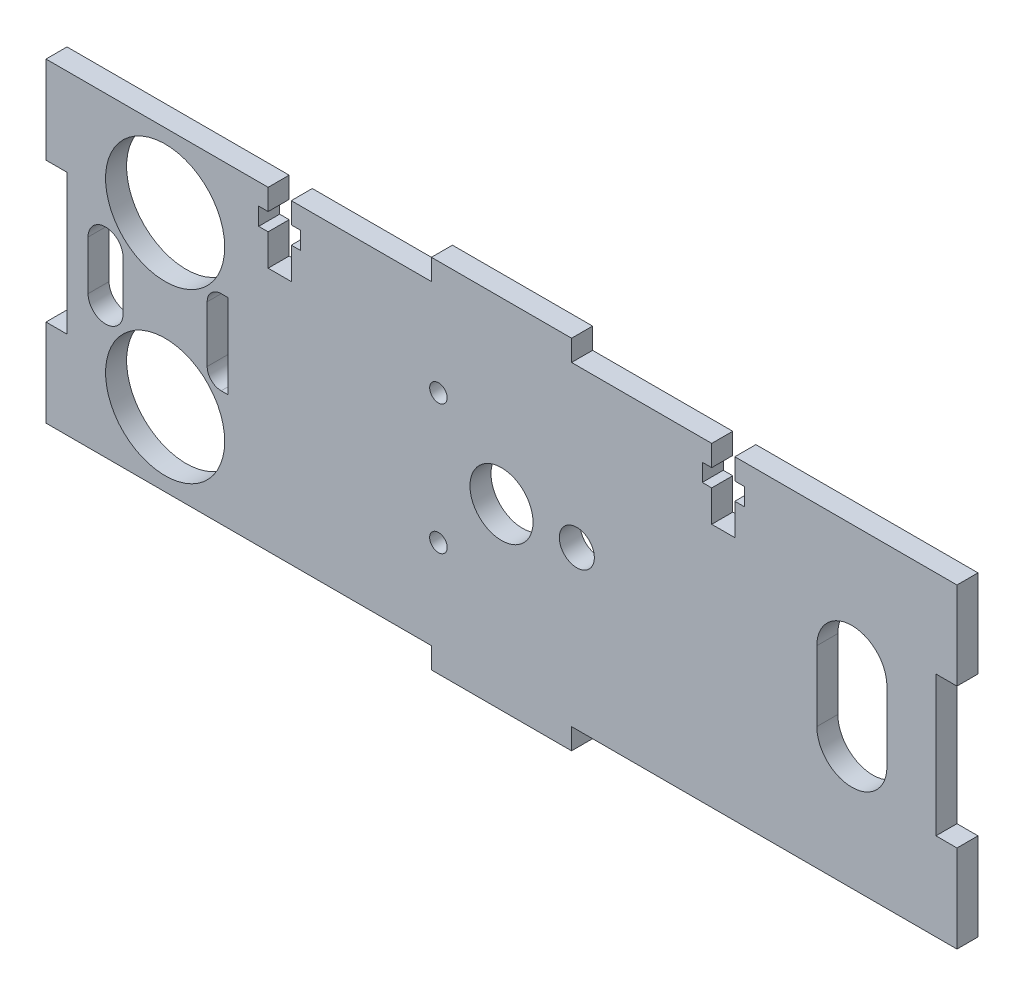
from build123d import *

# Parameters (mm, degrees)
SKETCH1_R           = 8.5
SKETCH1_R_2         = 4.5
SKETCH1_R_3         = 2.5
SKETCH1_R_4         = 1.25
BOSS_EXTRUDE1_DEPTH = 3


with BuildPart() as part:
    # Sketch1 → Boss-Extrude1 (new body)
    with BuildSketch(Plane.XY):
        Polygon((-10, -22.5), (-65, -22.5), (-65, -10), (-62, -10), (-62, 10), (-65, 10), (-65, 22.5), (-33.3, 22.5), (-33.3, 19.5), (-34.65, 19.5), (-34.65, 17), (-33.3, 17), (-33.3, 12.5), (-30, 12.5), (-30, 17), (-28.65, 17), (-28.65, 19.5), (-30, 19.5), (-30, 22.5), (-10, 22.5), (-10, 25.5), (10, 25.5), (10, 22.5), (30, 22.5), (30, 19.5), (28.65, 19.5), (28.65, 17), (30, 17), (30, 12.5), (33.3, 12.5), (33.3, 17), (34.65, 17), (34.65, 19.5), (33.3, 19.5), (33.3, 22.5), (65, 22.5), (65, 10), (62, 10), (62, -10), (65, -10), (65, -22.5), (10, -22.5), (10, -25.5), (-10, -25.5), align=None)
        with Locations((-48, 12)):
            Circle(SKETCH1_R, mode=Mode.SUBTRACT)
        with Locations((-48, -12)):
            Circle(SKETCH1_R, mode=Mode.SUBTRACT)
        Circle(SKETCH1_R_2, mode=Mode.SUBTRACT)
        with Locations((10.75, 0)):
            Circle(SKETCH1_R_3, mode=Mode.SUBTRACT)
        with Locations((-9, 9.25)):
            Circle(SKETCH1_R_4, mode=Mode.SUBTRACT)
        with Locations(Location((-9, -9.25, 0), (0, 0, 180))):
            Circle(SKETCH1_R_4, mode=Mode.SUBTRACT)
        with BuildLine():
            Line((-54, 3.5), (-54, -3.5))
            ThreePointArc((-54, -3.5), (-56.5, -6), (-59, -3.5))
            Line((-59, -3.5), (-59, 3.5))
            ThreePointArc((-59, 3.5), (-56.5, 6), (-54, 3.5))
        make_face(mode=Mode.SUBTRACT)
        with BuildLine():
            Line((-39, -6), (-40, -6))
            ThreePointArc((-40, -6), (-41.414213562, -5.414213562), (-42, -4))
            Line((-42, -4), (-42, 4))
            ThreePointArc((-42, 4), (-41.414213562, 5.414213562), (-40, 6))
            Line((-40, 6), (-39, 6))
            Line((-39, 6), (-39, -6))
        make_face(mode=Mode.SUBTRACT)
        with BuildLine():
            Line((45, -5), (45, 5))
            ThreePointArc((45, 5), (50, 10), (55, 5))
            Line((55, 5), (55, -5))
            ThreePointArc((55, -5), (50, -10), (45, -5))
        make_face(mode=Mode.SUBTRACT)
    extrude(amount=BOSS_EXTRUDE1_DEPTH)


solid = part.part
